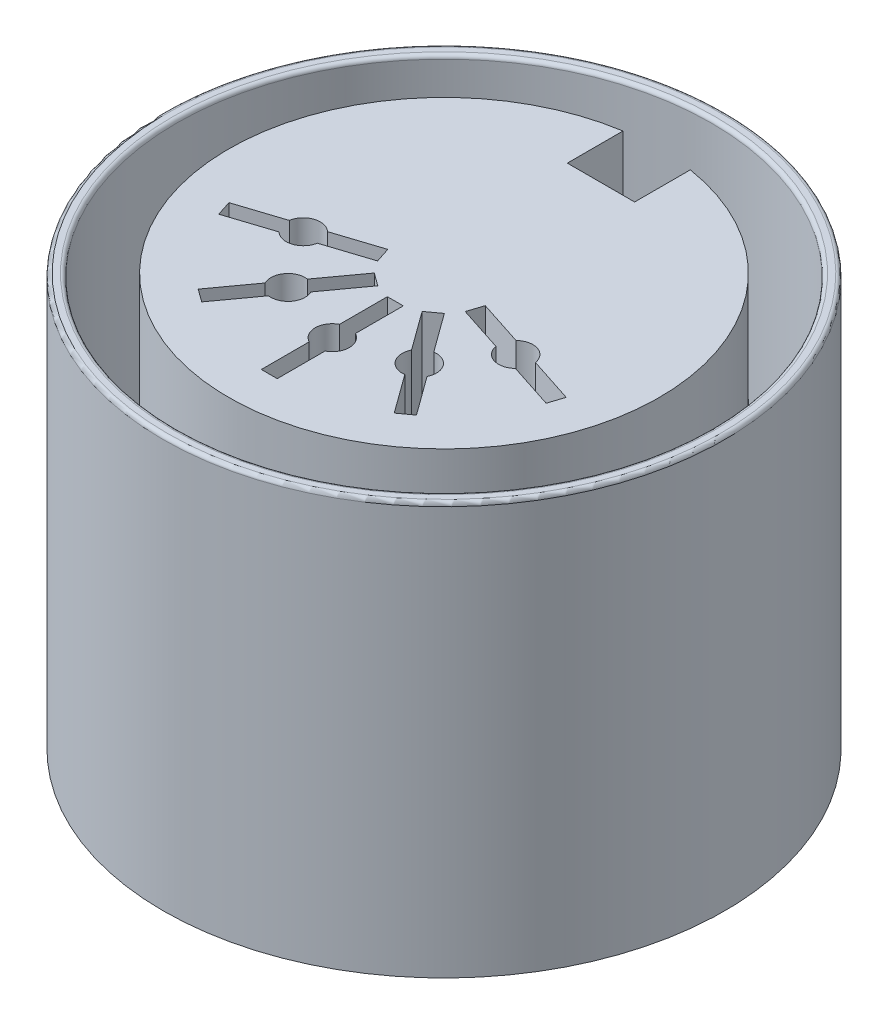
from build123d import *

# Parameters (mm, degrees)
SKETCH_1_R          = 5.75
EXTRUDE_1_DEPTH     = 10
SKETCH_2_W          = 1.797928006
SKETCH_2_H          = 1.699859207
CUT_EXTRUDE_1_DEPTH = 5
SKETCH_3_R          = 7.5
SKETCH_3_R_2        = 7.143263017
EXTRUDE_2_DEPTH     = 10
SKETCH_4_R          = 7.5
EXTRUDE_3_DEPTH     = 1
FILLET_2_R          = 0.1


with BuildPart() as part:
    # 草图1 → 凸台-拉伸1 (new body)
    with BuildSketch(Plane(origin=(0, 0, 0), x_dir=(1, 0, 0), z_dir=(0, 1, 0))):
        with Locations(Location((0, 0, 0), (0, 0, 270))):
            Circle(SKETCH_1_R)
    extrude(amount=EXTRUDE_1_DEPTH)

    # 草图2 → 切除-拉伸1 (cut)
    with BuildSketch(Plane(origin=(0, 10, 0), x_dir=(1, 0, 0), z_dir=(0, 1, 0))):
        with BuildLine():
            Line((0.212482401, -2.577588151), (0.212482401, -1.299411605))
            Line((0.212482401, -1.299411605), (-0.212482401, -1.299411605))
            Line((-0.212482401, -1.299411605), (-0.212482401, -2.577588151))
            ThreePointArc((-0.212482401, -2.577588151), (-0.457654402, -2.982926011), (-0.212482401, -3.388263872))
            Line((-0.212482401, -3.388263872), (-0.212482401, -4.666440418))
            Line((-0.212482401, -4.666440418), (0.212482401, -4.666440418))
            Line((0.212482401, -4.666440418), (0.212482401, -3.388263872))
            ThreePointArc((0.212482401, -3.388263872), (0.457654402, -2.982926011), (0.212482401, -2.577588151))
        make_face()
        with Locations((0, 5.04237082)):
            Rectangle(SKETCH_2_W, SKETCH_2_H)
        with BuildLine():
            Line((-1.343166429, -2.210206641), (-0.591873105, -1.176140093))
            Line((-0.591873105, -1.176140093), (-0.935676851, -0.92635205))
            Line((-0.935676851, -0.92635205), (-1.686970175, -1.960418597))
            ThreePointArc((-1.686970175, -1.960418597), (-2.123570107, -2.144235328), (-2.163473408, -2.616269032))
            Line((-2.163473408, -2.616269032), (-2.914766732, -3.65033558))
            Line((-2.914766732, -3.65033558), (-2.570962985, -3.900123623))
            Line((-2.570962985, -3.900123623), (-1.819669661, -2.866057075))
            ThreePointArc((-1.819669661, -2.866057075), (-1.38306973, -2.682240344), (-1.343166429, -2.210206641))
        make_face()
        with BuildLine():
            Line((-2.385771335, -0.998601315), (-1.170153201, -0.603623041))
            Line((-1.170153201, -0.603623041), (-1.301474547, -0.199457497))
            Line((-1.301474547, -0.199457497), (-2.517092681, -0.594435771))
            ThreePointArc((-2.517092681, -0.594435771), (-2.978354209, -0.48651963), (-3.288091107, -0.844948346))
            Line((-3.288091107, -0.844948346), (-4.50370924, -1.23992662))
            Line((-4.50370924, -1.23992662), (-4.372387895, -1.644092164))
            Line((-4.372387895, -1.644092164), (-3.156769761, -1.24911389))
            ThreePointArc((-3.156769761, -1.24911389), (-2.695508233, -1.357030032), (-2.385771335, -0.998601315))
        make_face()
        with BuildLine():
            Line((2.517092681, -0.594435771), (1.301474547, -0.199457497))
            Line((1.301474547, -0.199457497), (1.170153201, -0.603623041))
            Line((1.170153201, -0.603623041), (2.385771335, -0.998601315))
            ThreePointArc((2.385771335, -0.998601315), (2.695508233, -1.357030032), (3.156769761, -1.24911389))
            Line((3.156769761, -1.24911389), (4.372387895, -1.644092164))
            Line((4.372387895, -1.644092164), (4.50370924, -1.23992662))
            Line((4.50370924, -1.23992662), (3.288091107, -0.844948346))
            ThreePointArc((3.288091107, -0.844948346), (2.978354209, -0.48651963), (2.517092681, -0.594435771))
        make_face()
        with BuildLine():
            Line((1.686970175, -1.960418597), (0.935676851, -0.92635205))
            Line((0.935676851, -0.92635205), (0.591873105, -1.176140093))
            Line((0.591873105, -1.176140093), (1.343166429, -2.210206641))
            ThreePointArc((1.343166429, -2.210206641), (1.38306973, -2.682240344), (1.819669661, -2.866057075))
            Line((1.819669661, -2.866057075), (2.570962985, -3.900123623))
            Line((2.570962985, -3.900123623), (2.914766732, -3.65033558))
            Line((2.914766732, -3.65033558), (2.163473408, -2.616269032))
            ThreePointArc((2.163473408, -2.616269032), (2.123570107, -2.144235328), (1.686970175, -1.960418597))
        make_face()
    extrude(amount=-CUT_EXTRUDE_1_DEPTH, mode=Mode.SUBTRACT)



with BuildPart() as body_2:
    # 草图3 → 凸台-拉伸2 (new body)
    with BuildSketch(Plane(origin=(0, 0, 0), x_dir=(1, 0, 0), z_dir=(0, 1, 0))):
        with Locations(Location((0, 0, 0), (0, 0, 270))):
            Circle(SKETCH_3_R)
        with Locations(Location((0, 0, 0), (0, 0, 270))):
            Circle(SKETCH_3_R_2, mode=Mode.SUBTRACT)
    extrude(amount=EXTRUDE_2_DEPTH)


with BuildPart() as part_1:
    add(part.part)

    add(body_2.part)  # 凸台-拉伸3 merges body 2
    # 草图4 → 凸台-拉伸3 (add)
    with BuildSketch(Plane.XZ):
        with Locations(Location((0, 0, 0), (0, 0, 90))):
            Circle(SKETCH_4_R)
    extrude(amount=EXTRUDE_3_DEPTH)

    # 圆角2
    fillet_2_edges = [part_1.edges().sort_by_distance(p)[0] for p in [
        (0, 10, -7.5),
        (0, 10, -7.143263017),
    ]]
    fillet(fillet_2_edges, radius=FILLET_2_R)


solid = part_1.part
